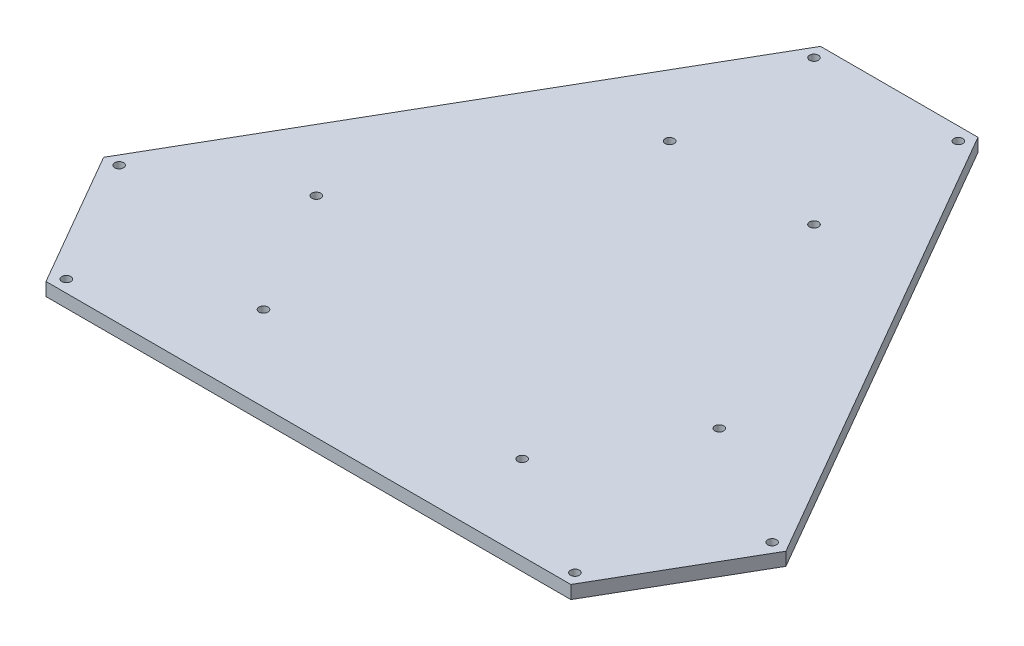
from build123d import *

# Parameters (mm, degrees)
SKETCH1_R           = 1.7
BOSS_EXTRUDE1_DEPTH = 5


with BuildPart() as part:
    # Sketch1 → Boss-Extrude1 (new body)
    with BuildSketch(Plane(origin=(0, 0, 0), x_dir=(1, 0, 0), z_dir=(0, 1, 0))):
        Polygon((-30, 132.790561914), (30, 132.790561914), (130, -40.414518843), (100, -92.37604307), (-100, -92.37604307), (-130, -40.414518843), align=None)
        with Locations(Location((-27.5, 127.790561914, 0), (0, 0, 270))):
            Circle(SKETCH1_R, mode=Mode.SUBTRACT)
        with Locations(Location((-27.5, 72.790561914, 0), (0, 0, 270))):
            Circle(SKETCH1_R, mode=Mode.SUBTRACT)
        with Locations(Location((27.5, 127.790561914, 0), (0, 0, 90))):
            Circle(SKETCH1_R, mode=Mode.SUBTRACT)
        with Locations(Location((27.5, 72.790561914, 0), (0, 0, 90))):
            Circle(SKETCH1_R, mode=Mode.SUBTRACT)
        with Locations(Location((76.788475773, -12.579582353, 0), (0, 0, 270))):
            Circle(SKETCH1_R, mode=Mode.SUBTRACT)
        with Locations(Location((49.288475773, -60.210979561, 0), (0, 0, 90))):
            Circle(SKETCH1_R, mode=Mode.SUBTRACT)
        with Locations(Location((96.919872981, -87.710979561, 0), (0, 0, 90))):
            Circle(SKETCH1_R, mode=Mode.SUBTRACT)
        with Locations(Location((124.419872981, -40.079582353, 0), (0, 0, 270))):
            Circle(SKETCH1_R, mode=Mode.SUBTRACT)
        with Locations(Location((-49.288475773, -60.210979561, 0), (0, 0, 270))):
            Circle(SKETCH1_R, mode=Mode.SUBTRACT)
        with Locations(Location((-76.788475773, -12.579582353, 0), (0, 0, 90))):
            Circle(SKETCH1_R, mode=Mode.SUBTRACT)
        with Locations(Location((-124.419872981, -40.079582353, 0), (0, 0, 90))):
            Circle(SKETCH1_R, mode=Mode.SUBTRACT)
        with Locations(Location((-96.919872981, -87.710979561, 0), (0, 0, 270))):
            Circle(SKETCH1_R, mode=Mode.SUBTRACT)
    extrude(amount=BOSS_EXTRUDE1_DEPTH)


solid = part.part
